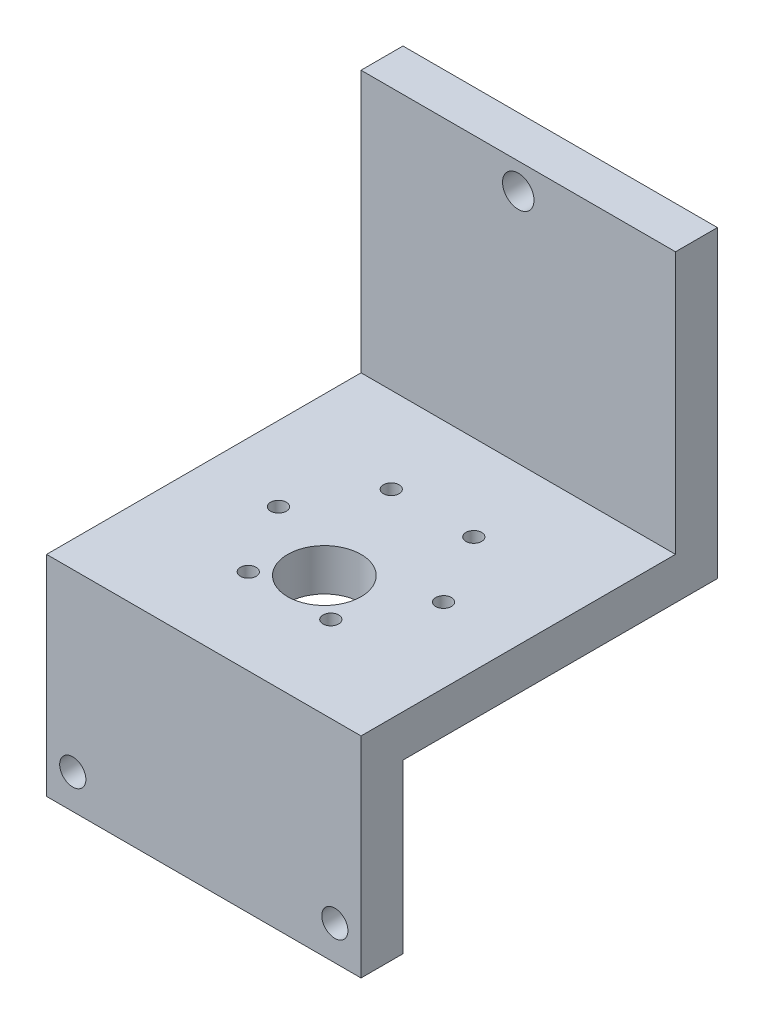
from build123d import *

# Parameters (mm, degrees)
BOSS_EXTRUDE1_DEPTH = 30
SKETCH2_R           = 7
SKETCH2_R_2         = 1.5
CUT_EXTRUDE1_DEPTH  = 55
SKETCH3_R           = 3
CUT_EXTRUDE2_DEPTH  = 55
SKETCH4_W           = 8
SKETCH4_H           = 40
BOSS_EXTRUDE2_DEPTH = 60
SKETCH5_R           = 2.5
CUT_EXTRUDE3_DEPTH  = 10


with BuildPart() as part:
    # Sketch1 → Boss-Extrude1 (new, symmetric)
    with BuildSketch(Plane(origin=(0, 0, 0), x_dir=(0, 0, -1), z_dir=(1, 0, 0))):
        Polygon((0, 50), (0, 0), (-52, 0), (-52, -8), (8, -8), (8, 50), align=None)
    extrude(amount=BOSS_EXTRUDE1_DEPTH, both=True)

    # Sketch2 → Cut-Extrude1 (cut)
    with BuildSketch(Plane(origin=(0, 0, 0), x_dir=(1, 0, 0), z_dir=(0, 1, 0))):
        with Locations(Location((0, -37, 0), (0, 0, 270))):
            Circle(SKETCH2_R)
        with Locations(Location((15.75, -30, 0), (0, 0, 270))):
            Circle(SKETCH2_R_2)
        with Locations(Location((7.875, -43.63990011, 0), (0, 0, 270))):
            Circle(SKETCH2_R_2)
        with Locations(Location((-7.875, -43.63990011, 0), (0, 0, 270))):
            Circle(SKETCH2_R_2)
        with Locations(Location((-15.75, -30, 0), (0, 0, 270))):
            Circle(SKETCH2_R_2)
        with Locations(Location((-7.875, -16.36009989, 0), (0, 0, 270))):
            Circle(SKETCH2_R_2)
        with Locations(Location((7.875, -16.36009989, 0), (0, 0, 270))):
            Circle(SKETCH2_R_2)
    extrude(amount=-CUT_EXTRUDE1_DEPTH, mode=Mode.SUBTRACT)

    # Sketch3 → Cut-Extrude2 (cut)
    with BuildSketch(Plane.XY):
        with Locations((0, 45)):
            Circle(SKETCH3_R)
    extrude(amount=-CUT_EXTRUDE2_DEPTH, mode=Mode.SUBTRACT)

    # Sketch4 → Boss-Extrude2 (add)
    with BuildSketch(Plane(origin=(30, 0, 0), x_dir=(0, 0, -1), z_dir=(1, 0, 0))):
        with Locations((-56, -20)):
            Rectangle(SKETCH4_W, SKETCH4_H)
    extrude(amount=-BOSS_EXTRUDE2_DEPTH)

    # Sketch5 → Cut-Extrude3 (cut)
    with BuildSketch(Plane.XY.offset(60)):
        with Locations((25, -33.45)):
            Circle(SKETCH5_R)
        with Locations((-25, -33.45)):
            Circle(SKETCH5_R)
    extrude(amount=-CUT_EXTRUDE3_DEPTH, mode=Mode.SUBTRACT)


solid = part.part
